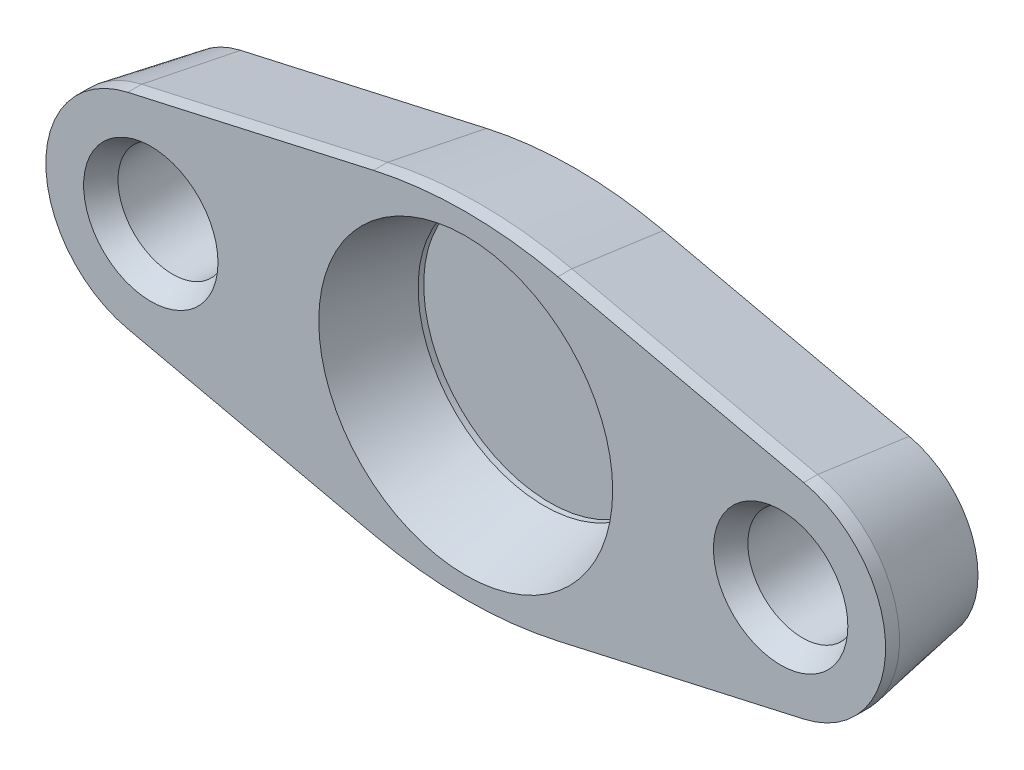
from build123d import *

# Parameters (mm, degrees)
SKETCH1_R           = 1.3
BOSS_EXTRUDE1_DEPTH = 2.6
SKETCH2_R           = 3
CUT_EXTRUDE1_DEPTH  = 2
CHAMFER1_SIZE       = 0.4
CHAMFER1_SIZE2      = 2.268512728
CHAMFER2_SIZE       = 0.5
CHAMFER2_SIZE2      = 1.866025404
CHAMFER3_SIZE       = 0.3
CHAMFER3_SIZE2      = 0.519615242


with BuildPart() as part:
    # Sketch1 → Boss-Extrude1 (new body)
    with BuildSketch(Plane.XY):
        with BuildLine():
            Line((-8.048780488, 2.43902439), (-2.195121951, 3.756097561))
            ThreePointArc((-2.195121951, 3.756097561), (0, 4), (2.195121951, 3.756097561))
            Line((2.195121951, 3.756097561), (8.048780488, 2.43902439))
            ThreePointArc((8.048780488, 2.43902439), (10, 0), (8.048780488, -2.43902439))
            Line((8.048780488, -2.43902439), (2.195121951, -3.756097561))
            ThreePointArc((2.195121951, -3.756097561), (0, -4), (-2.195121951, -3.756097561))
            Line((-2.195121951, -3.756097561), (-8.048780488, -2.43902439))
            ThreePointArc((-8.048780488, -2.43902439), (-10, 0), (-8.048780488, 2.43902439))
        make_face()
        with Locations((7.5, 0)):
            Circle(SKETCH1_R, mode=Mode.SUBTRACT)
        with Locations((-7.5, 0)):
            Circle(SKETCH1_R, mode=Mode.SUBTRACT)
    extrude(amount=BOSS_EXTRUDE1_DEPTH)

    # Sketch2 → Cut-Extrude1 (cut)
    with BuildSketch(Plane.XY.offset(2.6)):
        Circle(SKETCH2_R)
    extrude(amount=-CUT_EXTRUDE1_DEPTH, mode=Mode.SUBTRACT)

    # Chamfer1
    chamfer1_edges = [part.edges().sort_by_distance(p)[0] for p in [
        (-5.12195122, -3.097560976, 0),
        (-10, 0, 0),
        (-5.12195122, 3.097560976, 0),
        (0, 4, 0),
        (5.12195122, 3.097560976, 0),
        (10, 0, 0),
        (5.12195122, -3.097560976, 0),
        (0, -4, 0),
    ]]
    chamfer1_side = [part.faces().sort_by_distance(p)[0] for p in [
        (0, 0, 0),
    ]]
    chamfer(chamfer1_edges, length=CHAMFER1_SIZE, length2=CHAMFER1_SIZE2, reference=chamfer1_side[0])

    # Chamfer2
    chamfer2_edges = [part.edges().sort_by_distance(p)[0] for p in [
        (-3, 0, 2.6),
    ]]
    chamfer2_side = [part.faces().sort_by_distance(p)[0] for p in [
        (-5.074666846, 2.887408203, 2.6),
    ]]
    chamfer(chamfer2_edges, length=CHAMFER2_SIZE, length2=CHAMFER2_SIZE2, reference=chamfer2_side[0])

    # Chamfer3
    chamfer3_edges = [part.edges().sort_by_distance(p)[0] for p in [
        (6.2, 0, 2.6),
        (-8.8, 0, 2.6),
    ]]
    chamfer3_side = [part.faces().sort_by_distance(p)[0] for p in [
        (-3.715406592, 0, 2.6),
    ]]
    chamfer(chamfer3_edges, length=CHAMFER3_SIZE, length2=CHAMFER3_SIZE2, reference=chamfer3_side[0])


solid = part.part
